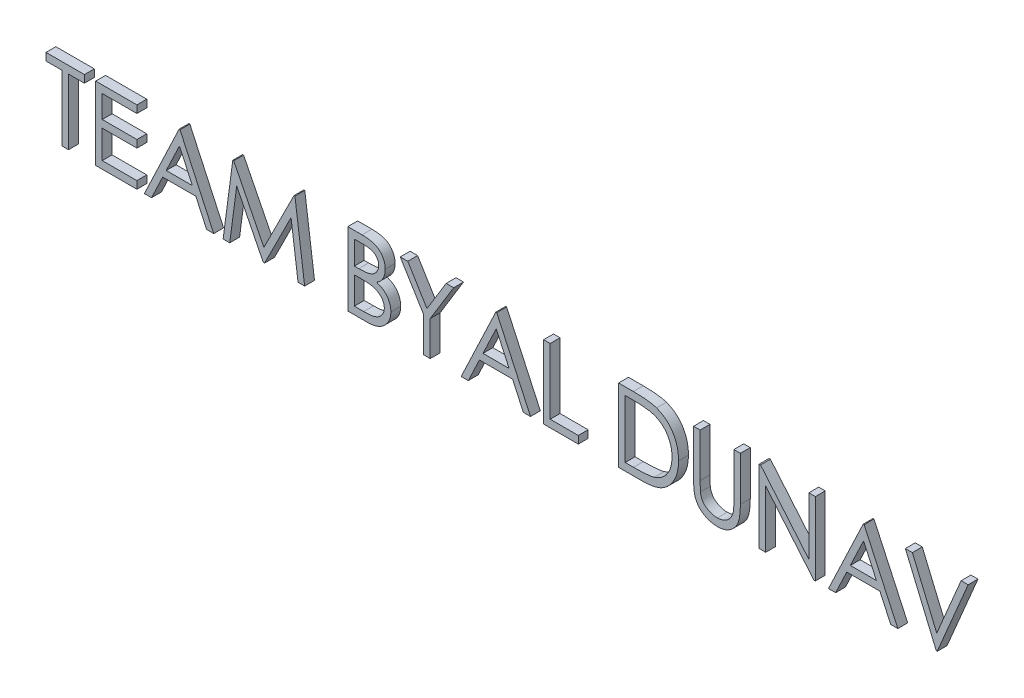
from build123d import *

# Parameters (mm, degrees)
BOSS_EXTRUDE1_DEPTH    = 1
BOSS_EXTRUDE1_2_DEPTH  = 1
BOSS_EXTRUDE1_3_DEPTH  = 1
BOSS_EXTRUDE1_4_DEPTH  = 1
BOSS_EXTRUDE1_5_DEPTH  = 1
BOSS_EXTRUDE1_6_DEPTH  = 1
BOSS_EXTRUDE1_7_DEPTH  = 1
BOSS_EXTRUDE1_8_DEPTH  = 1
BOSS_EXTRUDE1_9_DEPTH  = 1
BOSS_EXTRUDE1_10_DEPTH = 1
BOSS_EXTRUDE1_11_DEPTH = 1
BOSS_EXTRUDE1_12_DEPTH = 1
BOSS_EXTRUDE1_13_DEPTH = 1


with BuildPart() as part:
    # Sketch1 → Boss-Extrude1 (new body)
    with BuildSketch(Plane.XY):
        Polygon((-60.210936536, 6.648504274), (-60.210936536, 7.408333333), (-56.316812605, 7.408333333), (-56.316812605, 6.648504274), (-57.931449357, 6.648504274), (-57.931449357, 0), (-58.596299784, 0), (-58.596299784, 6.648504274), align=None)
    extrude(amount=BOSS_EXTRUDE1_DEPTH)


with BuildPart() as body_2:
    # Sketch1 → Boss-Extrude1 2 (new body)
    with BuildSketch(Plane.XY):
        Polygon((-55.177069015, 7.408333333), (-50.998009186, 7.408333333), (-50.998009186, 6.648504274), (-54.512218588, 6.648504274), (-54.512218588, 4.369017094), (-50.998009186, 4.369017094), (-50.998009186, 3.609188034), (-54.512218588, 3.609188034), (-54.512218588, 0.75982906), (-50.998009186, 0.75982906), (-50.998009186, 0), (-55.177069015, 0), align=None)
    extrude(amount=BOSS_EXTRUDE1_2_DEPTH)


with BuildPart() as body_3:
    # Sketch1 → Boss-Extrude1 3 (new body)
    with BuildSketch(Plane.XY):
        Polygon((-46.628992092, 7.408333333), (-43.209761323, 0), (-43.932489354, 0), (-45.02771171, 2.374465812), (-48.386096793, 2.374465812), (-49.512484012, 0), (-50.238180126, 0), (-46.723970724, 7.408333333), align=None)
        Polygon((-46.683901614, 5.964361311), (-48.025474797, 3.134294872), (-45.377945417, 3.134294872), align=None, mode=Mode.SUBTRACT)
    extrude(amount=BOSS_EXTRUDE1_3_DEPTH)


with BuildPart() as body_4:
    # Sketch1 → Boss-Extrude1 4 (new body)
    with BuildSketch(Plane.XY):
        Polygon((-42.259974998, 0), (-41.281991891, 7.408333333), (-41.187013259, 7.408333333), (-38.128404485, 1.329700855), (-35.077215917, 7.408333333), (-34.980753243, 7.408333333), (-33.996833972, 0), (-34.664652482, 0), (-35.374024143, 5.330675748), (-38.048266264, 0), (-38.198154418, 0), (-40.882784827, 5.342548077), (-41.590672447, 0), align=None)
    extrude(amount=BOSS_EXTRUDE1_4_DEPTH)


with BuildPart() as body_5:
    # Sketch1 → Boss-Extrude1 5 (new body)
    with BuildSketch(Plane.XY):
        with BuildLine():
            Line((-29.627816878, 7.408333333), (-28.182360815, 7.408333333))
            add(Edge.make_bspline(
                [(-28.182360815, 7.408333333), (-28.11160387, 7.407961328), (-27.974459299, 7.40724029), (-27.775028147, 7.396057662), (-27.588234832, 7.380809895), (-27.41402518, 7.356616198), (-27.252479693, 7.327423603), (-27.103111528, 7.292071426), (-26.966395663, 7.24968176), (-26.803173705, 7.182273799), (-26.617074972, 7.082106426), (-26.415571708, 6.934090963), (-26.243266068, 6.753047249), (-26.09470503, 6.548825628), (-25.97659266, 6.324171578), (-25.891144314, 6.084439629), (-25.837046811, 5.832721942), (-25.831483292, 5.659910548), (-25.828671579, 5.572574452)],
                knots=[0, 0, 0, 0, 1.001505555, 1.941167018, 2.826882275, 3.653841531, 4.429895133, 5.150066043, 5.825578002, 6.45369114, 7.647487171, 8.808567382, 9.977351308, 11.170798116, 12.373658725, 13.556498008, 14.765093433, 16, 16, 16, 16], degree=3))
            add(Edge.make_bspline(
                [(-25.828671579, 5.572574452), (-25.830985558, 5.490759876), (-25.835532745, 5.329986519), (-25.879014919, 5.094837321), (-25.947088334, 4.870997241), (-26.041714445, 4.659283192), (-26.164697003, 4.46447871), (-26.310447111, 4.285012331), (-26.48629301, 4.128482593), (-26.618041201, 4.04097345), (-26.684963312, 3.99652277)],
                knots=[0, 0, 0, 0, 1.044552857, 2.05264487, 3.044412934, 4.028983338, 5.005914585, 5.980388656, 6.974128949, 8, 8, 8, 8], degree=3))
            add(Edge.make_bspline(
                [(-26.684963312, 3.99652277), (-26.600803741, 3.964211855), (-26.439785632, 3.902393072), (-26.218200239, 3.793098007), (-26.027287817, 3.67422154), (-25.865580525, 3.544402457), (-25.727282489, 3.404472141), (-25.606520429, 3.252378815), (-25.503478187, 3.086138445), (-25.415185832, 2.907484295), (-25.346290965, 2.718240603), (-25.294695301, 2.520182461), (-25.265130867, 2.314020069), (-25.260923693, 2.173716016), (-25.258799784, 2.102886285)],
                knots=[0, 0, 0, 0, 1.27268992, 2.434971085, 3.483601985, 4.442670788, 5.356604649, 6.2567628, 7.179492994, 8.113709626, 9.066344395, 10.018646069, 10.999752585, 12, 12, 12, 12], degree=3))
            add(Edge.make_bspline(
                [(-25.258799784, 2.102886285), (-25.260867442, 2.030566405), (-25.264935615, 1.888275017), (-25.294949889, 1.679243315), (-25.345769166, 1.479483012), (-25.415769759, 1.287702042), (-25.507129991, 1.104271424), (-25.618314182, 0.928983348), (-25.750884325, 0.763599015), (-25.899184065, 0.606280679), (-26.066955606, 0.46482853), (-26.247963954, 0.338853617), (-26.444488664, 0.235251119), (-26.653302052, 0.148222207), (-26.876746521, 0.081743637), (-27.113818706, 0.035235022), (-27.364314145, 0.003897694), (-27.536208118, 0.001321277), (-27.624361349, 0)],
                knots=[0, 0, 0, 0, 0.978564426, 1.925352924, 2.850884081, 3.763762016, 4.682927383, 5.618979971, 6.567305752, 7.547517671, 8.540179244, 9.531824382, 10.526200242, 11.540722885, 12.589160233, 13.674978461, 14.80764778, 16, 16, 16, 16], degree=3))
            Line((-27.624361349, 0), (-29.627816878, 0))
            Line((-29.627816878, 0), (-29.627816878, 7.408333333))
        make_face()
        with BuildLine():
            Line((-28.962966451, 6.648504274), (-28.962966451, 4.274038462))
            Line((-28.962966451, 4.274038462), (-28.51627007, 4.274038462))
            add(Edge.make_bspline(
                [(-28.51627007, 4.274038462), (-28.450973453, 4.274884965), (-28.324807083, 4.276520583), (-28.142096635, 4.281205861), (-27.97249868, 4.294325053), (-27.816305966, 4.307440474), (-27.67376446, 4.328765018), (-27.545189953, 4.354148345), (-27.42856459, 4.380993827), (-27.294072552, 4.426649241), (-27.141518144, 4.494123654), (-26.978888074, 4.59883904), (-26.83551678, 4.723562254), (-26.714449399, 4.867476457), (-26.61536512, 5.025943217), (-26.546544423, 5.196434114), (-26.499877671, 5.37470006), (-26.495662263, 5.497082028), (-26.493522006, 5.559218082)],
                knots=[0, 0, 0, 0, 1.156816544, 2.235205308, 3.236616184, 4.169592532, 5.011045266, 5.787822928, 6.49130361, 7.128639758, 8.301311294, 9.436451833, 10.541879658, 11.654887649, 12.756523258, 13.837046038, 14.901820046, 16, 16, 16, 16], degree=3))
            add(Edge.make_bspline(
                [(-26.493522006, 5.559218082), (-26.494635754, 5.600335965), (-26.496820493, 5.680993183), (-26.514713317, 5.798572649), (-26.545124683, 5.909155259), (-26.58418627, 6.014256459), (-26.638772328, 6.110589875), (-26.703041658, 6.201486306), (-26.780693036, 6.28385029), (-26.869079348, 6.360832395), (-26.9706976, 6.429083312), (-27.085487167, 6.488859594), (-27.215001084, 6.536994238), (-27.357056627, 6.579150094), (-27.513840429, 6.60875865), (-27.683543233, 6.633424987), (-27.867555055, 6.645982624), (-27.994862189, 6.647644975), (-28.060669442, 6.648504274)],
                knots=[0, 0, 0, 0, 0.91205012, 1.789085906, 2.630437955, 3.453916878, 4.269457761, 5.079663411, 5.91843418, 6.774407191, 7.675494373, 8.627863946, 9.638891023, 10.736472738, 11.911756761, 13.175263542, 14.539845004, 16, 16, 16, 16], degree=3))
            Line((-28.060669442, 6.648504274), (-28.962966451, 6.648504274))
        make_face(mode=Mode.SUBTRACT)
        with BuildLine():
            Line((-28.962966451, 3.514209402), (-28.962966451, 0.75982906))
            Line((-28.962966451, 0.75982906), (-28.016148208, 0.75982906))
            add(Edge.make_bspline(
                [(-28.016148208, 0.75982906), (-27.948374815, 0.760641325), (-27.817750534, 0.762206859), (-27.629152931, 0.767317667), (-27.454352028, 0.778942984), (-27.294145474, 0.797243365), (-27.146803349, 0.817094416), (-27.014093211, 0.843788294), (-26.894939285, 0.874371927), (-26.756775333, 0.921645925), (-26.601192907, 0.995086788), (-26.433529928, 1.105818568), (-26.2844611, 1.237736236), (-26.157873301, 1.390413338), (-26.054129142, 1.556426313), (-25.978658429, 1.732417304), (-25.932111115, 1.915478337), (-25.92647619, 2.040291211), (-25.923650211, 2.102886285)],
                knots=[0, 0, 0, 0, 1.160039823, 2.235823828, 3.228722157, 4.157150951, 4.99529583, 5.772374946, 6.472645482, 7.099169577, 8.269452708, 9.405989375, 10.527446681, 11.663510218, 12.788923519, 13.866172445, 14.929861265, 16, 16, 16, 16], degree=3))
            add(Edge.make_bspline(
                [(-25.923650211, 2.102886285), (-25.924234632, 2.142030522), (-25.925394047, 2.219687597), (-25.942879015, 2.333809414), (-25.968308373, 2.444354179), (-26.001183242, 2.551622063), (-26.049061114, 2.65367371), (-26.104954967, 2.752527461), (-26.170489934, 2.848313992), (-26.272606752, 2.969413262), (-26.421137452, 3.108937606), (-26.63218346, 3.245541986), (-26.872154824, 3.355709844), (-27.046203018, 3.402487069), (-27.136111817, 3.426650975)],
                knots=[0, 0, 0, 0, 0.723448775, 1.435228256, 2.130040452, 2.821711965, 3.505591119, 4.210454504, 4.921174351, 5.648778258, 7.137944449, 8.670945889, 10.280296675, 12, 12, 12, 12], degree=3))
            add(Edge.make_bspline(
                [(-27.136111817, 3.426650975), (-27.172156736, 3.433964236), (-27.250309557, 3.449820894), (-27.377748935, 3.466558867), (-27.523239858, 3.48147091), (-27.687118281, 3.492501194), (-27.869591545, 3.503902711), (-28.071049356, 3.508336749), (-28.290669006, 3.513626849), (-28.44305286, 3.51401025), (-28.522206234, 3.514209402)],
                knots=[0, 0, 0, 0, 0.634451884, 1.375622551, 2.216452059, 3.157844607, 4.20941857, 5.370758133, 6.634282058, 8, 8, 8, 8], degree=3))
            Line((-28.522206234, 3.514209402), (-28.962966451, 3.514209402))
        make_face(mode=Mode.SUBTRACT)
    extrude(amount=BOSS_EXTRUDE1_5_DEPTH)


with BuildPart() as body_6:
    # Sketch1 → Boss-Extrude1 6 (new body)
    with BuildSketch(Plane.XY):
        Polygon((-24.309013459, 7.408333333), (-23.547700358, 7.408333333), (-21.600638393, 4.225065104), (-19.656544509, 7.408333333), (-18.895231408, 7.408333333), (-21.26969722, 3.521629607), (-21.26969722, 0), (-21.934547647, 0), (-21.934547647, 3.521629607), align=None)
    extrude(amount=BOSS_EXTRUDE1_6_DEPTH)


with BuildPart() as body_7:
    # Sketch1 → Boss-Extrude1 7 (new body)
    with BuildSketch(Plane.XY):
        Polygon((-14.526214314, 7.408333333), (-11.106983545, 0), (-11.829711576, 0), (-12.924933932, 2.374465812), (-16.283319015, 2.374465812), (-17.409706234, 0), (-18.135402348, 0), (-14.621192946, 7.408333333), align=None)
        Polygon((-14.581123836, 5.964361311), (-15.92269702, 3.134294872), (-13.275167639, 3.134294872), align=None, mode=Mode.SUBTRACT)
    extrude(amount=BOSS_EXTRUDE1_7_DEPTH)


with BuildPart() as body_8:
    # Sketch1 → Boss-Extrude1 8 (new body)
    with BuildSketch(Plane.XY):
        Polygon((-9.77728269, 7.408333333), (-9.112432263, 7.408333333), (-9.112432263, 0.75982906), (-6.263073288, 0.75982906), (-6.263073288, 0), (-9.77728269, 0), align=None)
    extrude(amount=BOSS_EXTRUDE1_8_DEPTH)


with BuildPart() as body_9:
    # Sketch1 → Boss-Extrude1 9 (new body)
    with BuildSketch(Plane.XY):
        with BuildLine():
            Line((-2.178992092, 0), (-2.178992092, 7.408333333))
            Line((-2.178992092, 7.408333333), (-0.68307863, 7.408333333))
            add(Edge.make_bspline(
                [(-0.68307863, 7.408333333), (-0.552969272, 7.40739656), (-0.301598669, 7.405586719), (0.061647678, 7.394111441), (0.397739976, 7.373811622), (0.705572861, 7.344242792), (0.985991426, 7.307935537), (1.23821048, 7.262426348), (1.463534182, 7.208688054), (1.602111165, 7.162871851), (1.667642524, 7.141205929)],
                knots=[0, 0, 0, 0, 1.314313732, 2.53924729, 3.670748893, 4.714932338, 5.66265055, 6.526160246, 7.303039223, 8, 8, 8, 8], degree=3))
            add(Edge.make_bspline(
                [(1.667642524, 7.141205929), (1.753356388, 7.108544269), (1.922840412, 7.043961607), (2.164155488, 6.922134102), (2.391327507, 6.784099704), (2.605574696, 6.629676461), (2.802003112, 6.454491923), (2.988286494, 6.265987759), (3.156804326, 6.057309105), (3.311126886, 5.832783714), (3.450267365, 5.595056537), (3.571211916, 5.344580557), (3.671656202, 5.0826278), (3.755038531, 4.809926736), (3.820753533, 4.525877737), (3.865588622, 4.230150054), (3.89516055, 3.923912436), (3.898132459, 3.716109821), (3.899640387, 3.610672075)],
                knots=[0, 0, 0, 0, 0.984719456, 1.947108742, 2.898477687, 3.838006223, 4.779231079, 5.722358779, 6.681677486, 7.655904652, 8.64651281, 9.637519902, 10.640069247, 11.656948941, 12.698408672, 13.768548281, 14.867775369, 16, 16, 16, 16], degree=3))
            add(Edge.make_bspline(
                [(3.899640387, 3.610672075), (3.898309072, 3.519102454), (3.895685578, 3.338654951), (3.872128526, 3.072715055), (3.837888649, 2.814664662), (3.78487843, 2.565732597), (3.720526443, 2.323737869), (3.638052323, 2.091259619), (3.543573856, 1.866165222), (3.433401613, 1.651498232), (3.312452348, 1.44812176), (3.182654658, 1.256403559), (3.044146986, 1.079079339), (2.895608563, 0.915612111), (2.738958897, 0.766248303), (2.573172397, 0.629740204), (2.397821273, 0.50875883), (2.21369091, 0.398550117), (2.01540977, 0.302410365), (1.799222186, 0.221066844), (1.564206193, 0.153658175), (1.310938651, 0.097416445), (1.038981956, 0.052802821), (0.748069479, 0.022901957), (0.438648182, 0.002681583), (0.226178737, 0.000911217), (0.11681954, 0)],
                knots=[0, 0, 0, 0, 1.105936401, 2.179363191, 3.223086493, 4.248585256, 5.251745608, 6.245858792, 7.225916811, 8.198733463, 9.158002045, 10.082870192, 10.993790845, 11.873723703, 12.748670949, 13.606408763, 14.465103618, 15.319838547, 16.196477973, 17.123216899, 18.106603292, 19.147568657, 20.255746949, 21.433717677, 22.679120308, 24, 24, 24, 24], degree=3))
            Line((0.11681954, 0), (-2.178992092, 0))
        make_face()
        with BuildLine():
            Line((-1.514141664, 0.75982906), (-0.663786096, 0.75982906))
            add(Edge.make_bspline(
                [(-0.663786096, 0.75982906), (-0.541594377, 0.760354197), (-0.306574954, 0.761364229), (0.031367807, 0.770227142), (0.340145863, 0.784709243), (0.619803058, 0.804976491), (0.870181492, 0.831791726), (1.09180443, 0.861689437), (1.283945393, 0.898937375), (1.400212701, 0.932700239), (1.453940601, 0.948302284)],
                knots=[0, 0, 0, 0, 1.375205317, 2.645023457, 3.804390687, 4.853969522, 5.800190428, 6.637939096, 7.370582563, 8, 8, 8, 8], degree=3))
            add(Edge.make_bspline(
                [(1.453940601, 0.948302284), (1.521564634, 0.972118082), (1.655197501, 1.019180839), (1.847562465, 1.105027888), (2.026964791, 1.206716936), (2.196531011, 1.319751749), (2.353855765, 1.44811912), (2.500803478, 1.589027713), (2.637078291, 1.743194654), (2.761272243, 1.910428596), (2.87241482, 2.089688663), (2.968662256, 2.279212528), (3.053014664, 2.476923609), (3.119221018, 2.685857995), (3.171112338, 2.904147835), (3.207867594, 3.131808487), (3.230758761, 3.368797433), (3.233428826, 3.529986096), (3.234789959, 3.612156116)],
                knots=[0, 0, 0, 0, 0.998632004, 1.973411704, 2.929992603, 3.868527914, 4.809262121, 5.754881198, 6.702106254, 7.672490631, 8.653608572, 9.636854334, 10.631411391, 11.644891563, 12.686317036, 13.754757253, 14.855430412, 16, 16, 16, 16], degree=3))
            add(Edge.make_bspline(
                [(3.234789959, 3.612156116), (3.233703501, 3.69879865), (3.231569144, 3.869008673), (3.204741854, 4.118755645), (3.165537895, 4.358956355), (3.108845759, 4.589626869), (3.036602066, 4.811217214), (2.946443407, 5.022501844), (2.843432397, 5.22571215), (2.720870334, 5.416157891), (2.586640661, 5.596271638), (2.43767415, 5.76127621), (2.276337502, 5.911547479), (2.104390404, 6.04942569), (1.916986877, 6.169363804), (1.718541565, 6.276650613), (1.506143227, 6.367700916), (1.358373021, 6.416127842), (1.28327587, 6.440738515)],
                knots=[0, 0, 0, 0, 1.122418816, 2.205001699, 3.251619955, 4.274784885, 5.280384055, 6.268708349, 7.249350384, 8.229342522, 9.199999885, 10.157847722, 11.105861043, 12.055065948, 13.010012805, 13.98527497, 14.976112212, 16, 16, 16, 16], degree=3))
            add(Edge.make_bspline(
                [(1.28327587, 6.440738515), (1.221149277, 6.457918287), (1.089051094, 6.494447197), (0.873490896, 6.534294235), (0.630888829, 6.569440425), (0.360167795, 6.599196608), (0.06163639, 6.620548105), (-0.264934983, 6.636574054), (-0.619687479, 6.647383093), (-0.865607176, 6.64812119), (-0.993243227, 6.648504274)],
                knots=[0, 0, 0, 0, 0.674548936, 1.434276114, 2.292660221, 3.240891867, 4.284742987, 5.42552168, 6.663806718, 8, 8, 8, 8], degree=3))
            Line((-0.993243227, 6.648504274), (-1.514141664, 6.648504274))
            Line((-1.514141664, 6.648504274), (-1.514141664, 0.75982906))
        make_face(mode=Mode.SUBTRACT)
    extrude(amount=BOSS_EXTRUDE1_9_DEPTH)


with BuildPart() as body_10:
    # Sketch1 → Boss-Extrude1 10 (new body)
    with BuildSketch(Plane.XY):
        with BuildLine():
            Line((5.419298507, 7.408333333), (6.084148934, 7.408333333))
            Line((6.084148934, 7.408333333), (6.084148934, 2.969566306))
            add(Edge.make_bspline(
                [(6.084148934, 2.969566306), (6.084049992, 2.906742082), (6.083862234, 2.787522291), (6.085116388, 2.617832721), (6.088628718, 2.466972683), (6.090843089, 2.334360664), (6.095769279, 2.220605182), (6.099786811, 2.125089941), (6.104952656, 2.048267212), (6.111161088, 2.003434252), (6.113829757, 1.984162994)],
                knots=[0, 0, 0, 0, 1.528628734, 2.90083645, 4.128790002, 5.200304208, 6.127813768, 6.898992206, 7.526736466, 8, 8, 8, 8], degree=3))
            add(Edge.make_bspline(
                [(6.113829757, 1.984162994), (6.124788711, 1.914637345), (6.146089122, 1.779503568), (6.200373955, 1.587081038), (6.276187665, 1.413659452), (6.366025439, 1.253827219), (6.484416133, 1.112033073), (6.626240283, 0.981410075), (6.79806656, 0.867169755), (6.989118175, 0.762710537), (7.195038594, 0.678752779), (7.405459108, 0.615266825), (7.617216747, 0.576576487), (7.758982963, 0.572096479), (7.829381306, 0.569871795)],
                knots=[0, 0, 0, 0, 1.035780045, 2.013197591, 2.933192213, 3.817615948, 4.702609284, 5.640816605, 6.646850145, 7.73207398, 8.84249596, 9.914020372, 10.964143139, 12, 12, 12, 12], degree=3))
            add(Edge.make_bspline(
                [(7.829381306, 0.569871795), (7.889820056, 0.572144778), (8.010348479, 0.576677616), (8.18943209, 0.604747645), (8.363845654, 0.655337176), (8.534450426, 0.720614664), (8.694366677, 0.806863732), (8.843683629, 0.906497009), (8.97695729, 1.02336003), (9.098576718, 1.152689093), (9.204483999, 1.298611669), (9.296286249, 1.457950395), (9.3714828, 1.633103179), (9.408616594, 1.756196706), (9.427693605, 1.819434428)],
                knots=[0, 0, 0, 0, 0.994687771, 1.983630487, 2.973142513, 3.978332533, 4.983357753, 5.956394766, 6.925816176, 7.893390482, 8.871859704, 9.88551698, 10.913711441, 12, 12, 12, 12], degree=3))
            add(Edge.make_bspline(
                [(9.427693605, 1.819434428), (9.434043871, 1.845572244), (9.448194821, 1.903817831), (9.461417732, 2.002287896), (9.475189878, 2.118470383), (9.484745718, 2.253200053), (9.494061634, 2.406025445), (9.499634972, 2.57774269), (9.502211025, 2.767728258), (9.502978698, 2.90031025), (9.503379703, 2.969566306)],
                knots=[0, 0, 0, 0, 0.558680831, 1.244966039, 2.062412453, 2.990489873, 4.051219941, 5.244515665, 6.560634259, 8, 8, 8, 8], degree=3))
            Line((9.503379703, 2.969566306), (9.503379703, 7.408333333))
            Line((9.503379703, 7.408333333), (10.16823013, 7.408333333))
            Line((10.16823013, 7.408333333), (10.16823013, 2.933949319))
            add(Edge.make_bspline(
                [(10.16823013, 2.933949319), (10.167692242, 2.85330775), (10.166642521, 2.695930826), (10.157539634, 2.465317116), (10.143025651, 2.246553305), (10.122519198, 2.039609988), (10.095347541, 1.845227684), (10.065131658, 1.661702591), (10.026651646, 1.49035209), (9.981707614, 1.329840139), (9.930328604, 1.177047469), (9.863778173, 1.032037568), (9.788796315, 0.890402089), (9.6998653, 0.754283259), (9.59993454, 0.623078388), (9.486795149, 0.497583179), (9.364189008, 0.375792198), (9.23007794, 0.260829541), (9.086672662, 0.155401175), (8.934399752, 0.062695893), (8.774428922, -0.015670764), (8.607176005, -0.080178137), (8.432569626, -0.128680706), (8.250605381, -0.164823119), (8.060869089, -0.185359649), (7.931827233, -0.188411734), (7.866482334, -0.189957265)],
                knots=[0, 0, 0, 0, 1.316592851, 2.569410997, 3.76748051, 4.895814652, 5.963796859, 6.97159953, 7.931736103, 8.829262218, 9.692595152, 10.560224239, 11.431080259, 12.30701507, 13.211635791, 14.121146779, 15.063487852, 16.031507147, 17.00238618, 17.966455255, 18.938106653, 19.907068911, 20.888905087, 21.893141452, 22.933117798, 24, 24, 24, 24], degree=3))
            add(Edge.make_bspline(
                [(7.866482334, -0.189957265), (7.795216067, -0.188296178), (7.655391905, -0.185037133), (7.449359663, -0.166362312), (7.251844614, -0.13118671), (7.060760675, -0.086398163), (6.878709356, -0.024625919), (6.703251565, 0.047548445), (6.537392357, 0.136188646), (6.378441001, 0.234811328), (6.230645267, 0.345776812), (6.094972431, 0.466723514), (5.971198505, 0.595713979), (5.861409764, 0.734144754), (5.763787225, 0.8809392), (5.679691607, 1.036512591), (5.60748524, 1.200804694), (5.570218006, 1.315005634), (5.551378167, 1.372738048)],
                knots=[0, 0, 0, 0, 1.13879206, 2.234305948, 3.301075583, 4.341971843, 5.366689343, 6.369221514, 7.369726634, 8.367512178, 9.355451585, 10.318319045, 11.268648973, 12.207971039, 13.137398894, 14.081662264, 15.030215811, 16, 16, 16, 16], degree=3))
            add(Edge.make_bspline(
                [(5.551378167, 1.372738048), (5.540419849, 1.412176997), (5.516651013, 1.497720956), (5.491197466, 1.639297357), (5.46979991, 1.802312266), (5.449679812, 1.986776841), (5.437807518, 2.192834059), (5.427398939, 2.420394598), (5.419225179, 2.669733617), (5.419273381, 2.843415675), (5.419298507, 2.933949319)],
                knots=[0, 0, 0, 0, 0.625038921, 1.35572334, 2.194682327, 3.136881307, 4.189498639, 5.346923369, 6.617055217, 8, 8, 8, 8], degree=3))
            Line((5.419298507, 2.933949319), (5.419298507, 7.408333333))
        make_face()
    extrude(amount=BOSS_EXTRUDE1_10_DEPTH)


with BuildPart() as body_11:
    # Sketch1 → Boss-Extrude1 11 (new body)
    with BuildSketch(Plane.XY):
        Polygon((12.06780278, 0), (12.06780278, 7.408333333), (12.207302646, 7.408333333), (17.101670301, 1.577535724), (17.101670301, 7.408333333), (17.766520729, 7.408333333), (17.766520729, 0), (17.615148533, 0), (12.732653207, 5.817441239), (12.732653207, 0), align=None)
    extrude(amount=BOSS_EXTRUDE1_11_DEPTH)


with BuildPart() as body_12:
    # Sketch1 → Boss-Extrude1 12 (new body)
    with BuildSketch(Plane.XY):
        Polygon((22.705409618, 7.408333333), (26.124640387, 0), (25.401912355, 0), (24.30669, 2.374465812), (20.948304917, 2.374465812), (19.821917697, 0), (19.096221583, 0), (22.610430985, 7.408333333), align=None)
        Polygon((22.650500096, 5.964361311), (21.308926912, 3.134294872), (23.956456292, 3.134294872), align=None, mode=Mode.SUBTRACT)
    extrude(amount=BOSS_EXTRUDE1_12_DEPTH)


with BuildPart() as body_13:
    # Sketch1 → Boss-Extrude1 13 (new body)
    with BuildSketch(Plane.XY):
        Polygon((26.884469447, 7.408333333), (27.59680919, 7.408333333), (30.066253635, 1.570115518), (32.535698079, 7.408333333), (33.248037823, 7.408333333), (30.113742951, 0), (30.018764318, 0), align=None)
    extrude(amount=BOSS_EXTRUDE1_13_DEPTH)


solid = Compound([part.part, body_2.part, body_3.part, body_4.part, body_5.part, body_6.part, body_7.part, body_8.part, body_9.part, body_10.part, body_11.part, body_12.part, body_13.part])
